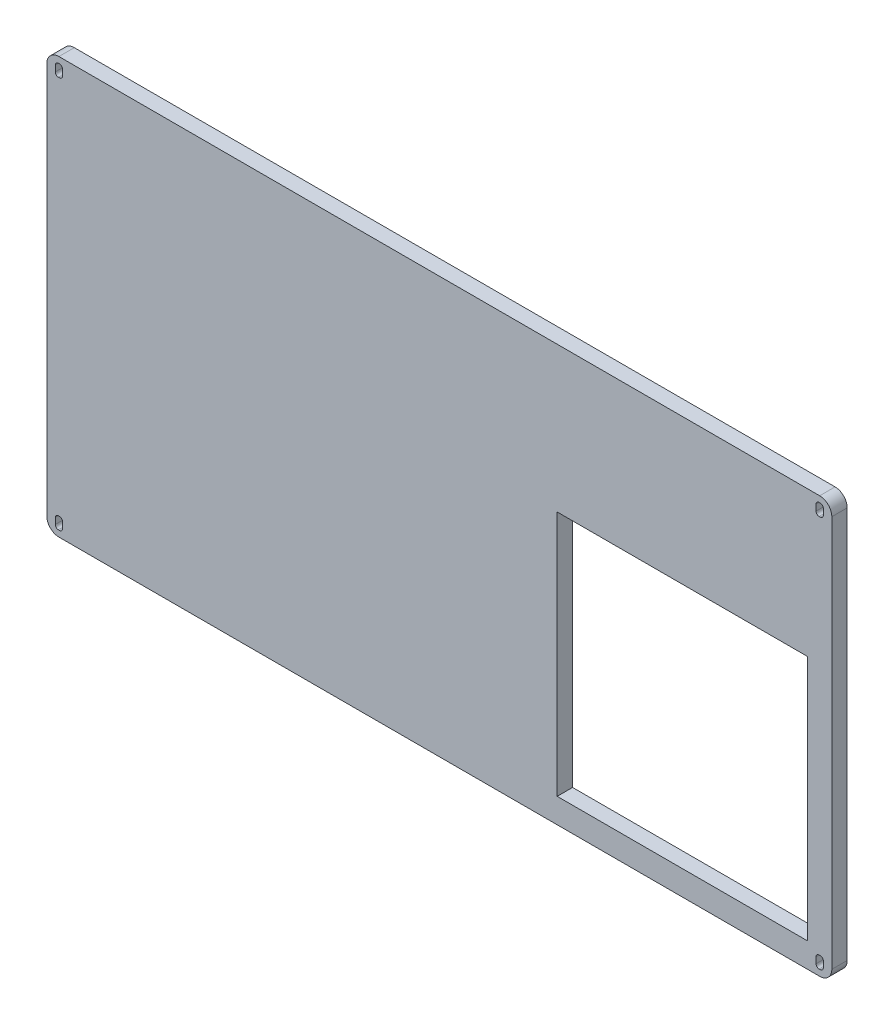
from build123d import *

# Parameters (mm, degrees)
SKETCH1_W           = 647.7
SKETCH1_H           = 343.408
SKETCH1_W_2         = 206.587092864
SKETCH1_H_2         = 203.2
BOSS_EXTRUDE1_DEPTH = 12.7
FILLET1_R           = 10


with BuildPart() as part:
    # Sketch1 → Boss-Extrude1 (new body)
    with BuildSketch(Plane.XY):
        with Locations((-66.978068182, 49.838840909)):
            Rectangle(SKETCH1_W, SKETCH1_H)
        with BuildLine():
            Line((247.371931818, -116.865159091), (246.371931818, -116.865159091))
            ThreePointArc((246.371931818, -116.865159091), (244.604164865, -116.132926044), (243.871931818, -114.365159091))
            Line((243.871931818, -114.365159091), (243.871931818, -109.365159091))
            ThreePointArc((243.871931818, -109.365159091), (244.604164865, -107.597392138), (246.371931818, -106.865159091))
            Line((246.371931818, -106.865159091), (247.371931818, -106.865159091))
            ThreePointArc((247.371931818, -106.865159091), (249.139698771, -107.597392138), (249.871931818, -109.365159091))
            Line((249.871931818, -109.365159091), (249.871931818, -114.365159091))
            ThreePointArc((249.871931818, -114.365159091), (249.139698771, -116.132926044), (247.371931818, -116.865159091))
        make_face(mode=Mode.SUBTRACT)
        with Locations((133.578385386, 0.072858907)):
            Rectangle(SKETCH1_W_2, SKETCH1_H_2, mode=Mode.SUBTRACT)
        with BuildLine():
            Line((-380.328068182, -116.865159091), (-381.328068182, -116.865159091))
            ThreePointArc((-381.328068182, -116.865159091), (-383.095835135, -116.132926044), (-383.828068182, -114.365159091))
            Line((-383.828068182, -114.365159091), (-383.828068182, -109.365159091))
            ThreePointArc((-383.828068182, -109.365159091), (-383.095835135, -107.597392138), (-381.328068182, -106.865159091))
            Line((-381.328068182, -106.865159091), (-380.328068182, -106.865159091))
            ThreePointArc((-380.328068182, -106.865159091), (-378.560301229, -107.597392138), (-377.828068182, -109.365159091))
            Line((-377.828068182, -109.365159091), (-377.828068182, -114.365159091))
            ThreePointArc((-377.828068182, -114.365159091), (-378.560301229, -116.132926044), (-380.328068182, -116.865159091))
        make_face(mode=Mode.SUBTRACT)
        with BuildLine():
            Line((-380.328068182, 206.544840909), (-381.328068182, 206.544840909))
            ThreePointArc((-381.328068182, 206.544840909), (-383.095835135, 207.277073956), (-383.828068182, 209.044840909))
            Line((-383.828068182, 209.044840909), (-383.828068182, 214.044840909))
            ThreePointArc((-383.828068182, 214.044840909), (-383.095835135, 215.812607862), (-381.328068182, 216.544840909))
            Line((-381.328068182, 216.544840909), (-380.328068182, 216.544840909))
            ThreePointArc((-380.328068182, 216.544840909), (-378.560301229, 215.812607862), (-377.828068182, 214.044840909))
            Line((-377.828068182, 214.044840909), (-377.828068182, 209.044840909))
            ThreePointArc((-377.828068182, 209.044840909), (-378.560301229, 207.277073956), (-380.328068182, 206.544840909))
        make_face(mode=Mode.SUBTRACT)
        with BuildLine():
            Line((247.371931818, 206.544840909), (246.371931818, 206.544840909))
            ThreePointArc((246.371931818, 206.544840909), (244.604164865, 207.277073956), (243.871931818, 209.044840909))
            Line((243.871931818, 209.044840909), (243.871931818, 214.044840909))
            ThreePointArc((243.871931818, 214.044840909), (244.604164865, 215.812607862), (246.371931818, 216.544840909))
            Line((246.371931818, 216.544840909), (247.371931818, 216.544840909))
            ThreePointArc((247.371931818, 216.544840909), (249.139698771, 215.812607862), (249.871931818, 214.044840909))
            Line((249.871931818, 214.044840909), (249.871931818, 209.044840909))
            ThreePointArc((249.871931818, 209.044840909), (249.139698771, 207.277073956), (247.371931818, 206.544840909))
        make_face(mode=Mode.SUBTRACT)
    extrude(amount=BOSS_EXTRUDE1_DEPTH)

    # Fillet1
    fillet1_edges = [part.edges().sort_by_distance(p)[0] for p in [
        (-390.828068182, 221.542840909, 6.35),
        (256.871931818, 221.542840909, 6.35),
        (256.871931818, -121.865159091, 6.35),
        (-390.828068182, -121.865159091, 6.35),
    ]]
    fillet(fillet1_edges, radius=FILLET1_R)


solid = part.part
